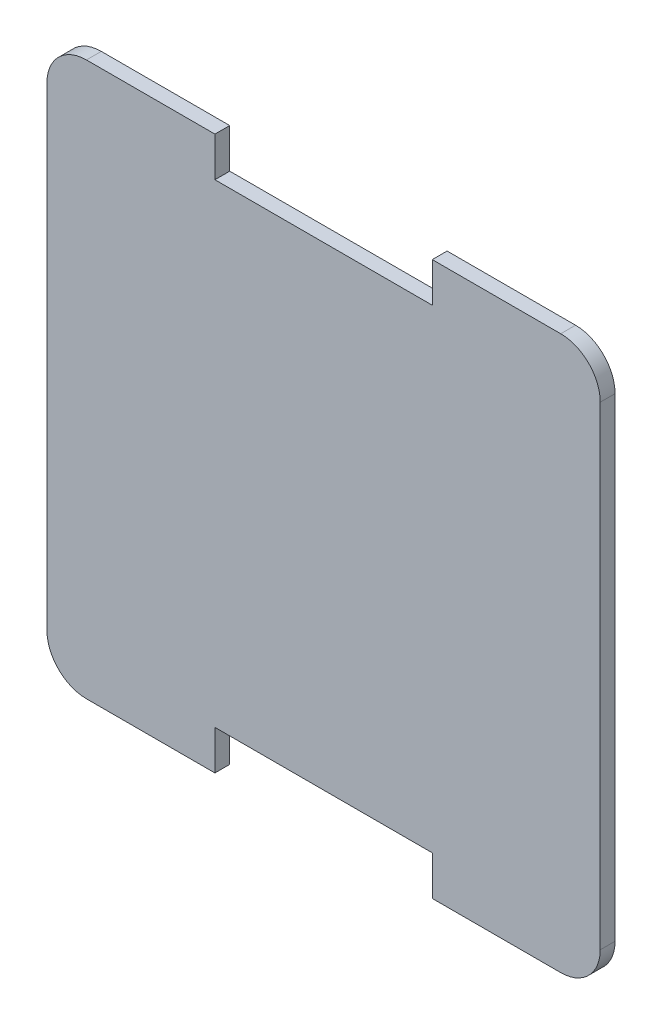
from build123d import *

# Parameters (mm, degrees)
BOSS_EXTRUDE1_DEPTH = 9.525
SKETCH2_W           = 139.7
SKETCH2_H           = 25.4
CUT_EXTRUDE1_DEPTH  = 503.984538157


with BuildPart() as part:
    # Sketch1 → Boss-Extrude1 (new body)
    with BuildSketch(Plane.XY):
        with BuildLine():
            Line((25.4, 0), (330.2, 0))
            ThreePointArc((330.2, 0), (348.160512242, 7.439487758), (355.6, 25.4))
            Line((355.6, 25.4), (355.6, 330.2))
            ThreePointArc((355.6, 330.2), (348.160512242, 348.160512242), (330.2, 355.6))
            Line((330.2, 355.6), (25.4, 355.6))
            ThreePointArc((25.4, 355.6), (7.439487758, 348.160512242), (0, 330.2))
            Line((0, 330.2), (0, 25.4))
            ThreePointArc((0, 25.4), (7.439487758, 7.439487758), (25.4, 0))
        make_face()
    extrude(amount=BOSS_EXTRUDE1_DEPTH)

    # Sketch2 → Cut-Extrude1 (cut, through all)
    with BuildSketch(Plane(origin=(0, 0, 0), x_dir=(-1, 0, 0), z_dir=(0, 0, -1))):
        with Locations((-177.8, 342.9)):
            Rectangle(SKETCH2_W, SKETCH2_H)
        with Locations((-177.8, 12.7)):
            Rectangle(SKETCH2_W, SKETCH2_H)
    extrude(amount=-CUT_EXTRUDE1_DEPTH, mode=Mode.SUBTRACT)


solid = part.part
